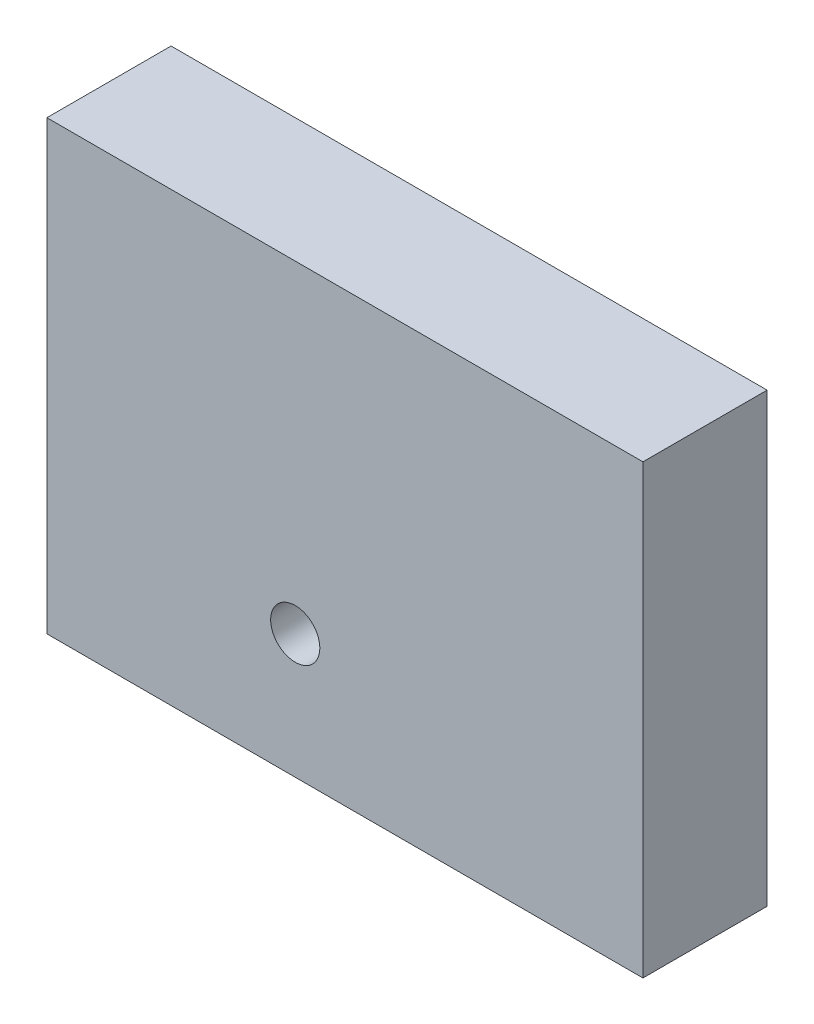
from build123d import *

# Parameters (mm, degrees)
IZIM1_W                     = 48
IZIM1_H                     = 36
IZIM1_W_2                   = 2.8
IZIM1_H_2                   = 2.8
Y_KSEKLIK_EKSTR_ZYON1_DEPTH = 10
IZIM2_R                     = 1.979898987
KES_EKSTR_ZYON2_DEPTH       = 10


with BuildPart() as part:
    # Çizim1 → Yükseklik-Ekstrüzyon1 (new body)
    with BuildSketch(Plane.XY):
        Rectangle(IZIM1_W, IZIM1_H)
        with Locations((-4, -8)):
            Rectangle(IZIM1_W_2, IZIM1_H_2, mode=Mode.SUBTRACT)
    extrude(amount=Y_KSEKLIK_EKSTR_ZYON1_DEPTH)

    # Çizim2 → Kes-Ekstrüzyon2 (cut)
    with BuildSketch(Plane.XY.offset(10)):
        with Locations((-4, -8)):
            Circle(IZIM2_R)
    extrude(amount=-KES_EKSTR_ZYON2_DEPTH, mode=Mode.SUBTRACT)


solid = part.part
